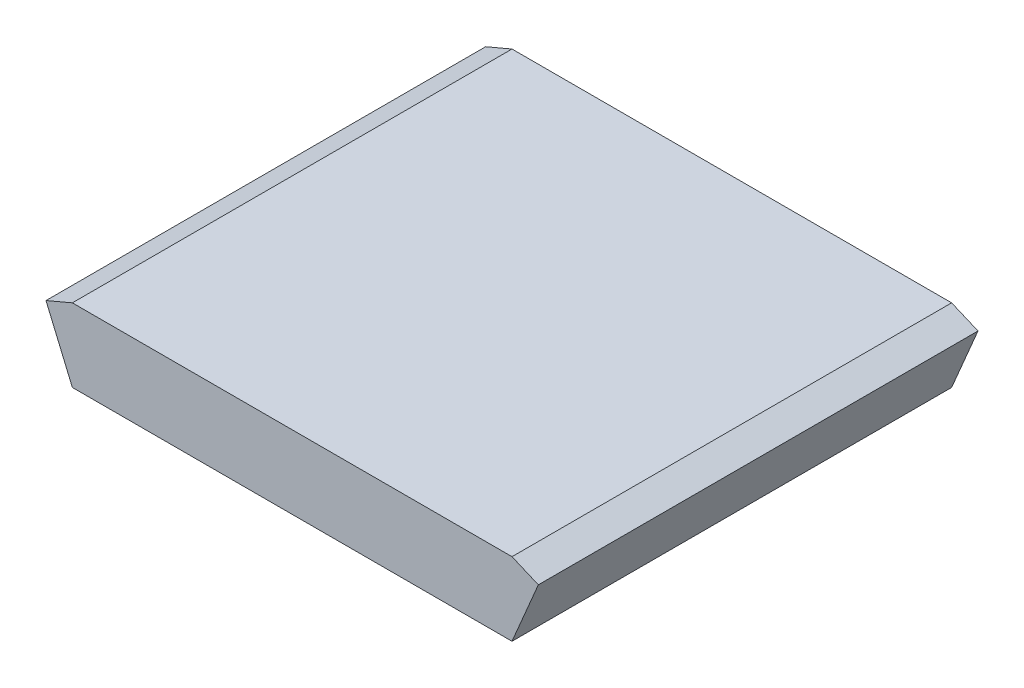
from build123d import *

# Parameters (mm, degrees)
BOSS_EXTRUDE1_DEPTH      = 1.5
BOSS_EXTRUDE1_DEPTH_BACK = 1.5
SKETCH2_W                = 3
SKETCH2_H                = 0.5


with BuildPart() as part:
    # Sketch2 → Boss-Extrude1 (new, two sides: drawn at the far end of the back side and taken through both)
    with BuildSketch(Plane.XY.offset(-BOSS_EXTRUDE1_DEPTH_BACK)):
        Polygon((-1.67983495, 0.173664593), (-1.5, 0.25), (-1.5, -0.25), align=None)
        Rectangle(SKETCH2_W, SKETCH2_H)
        Polygon((1.5, -0.25), (1.5, 0.25), (1.67983495, 0.173664593), align=None)
    extrude(amount=BOSS_EXTRUDE1_DEPTH + BOSS_EXTRUDE1_DEPTH_BACK)


solid = part.part
